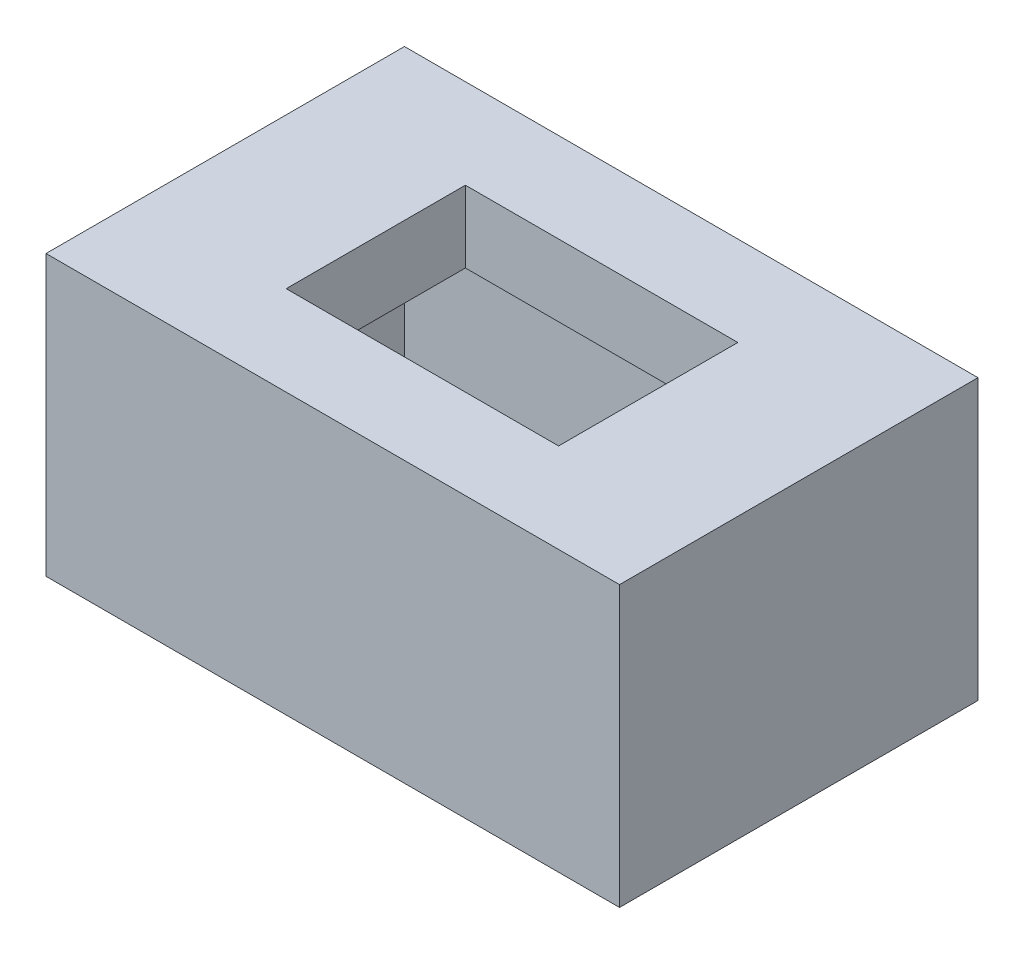
from build123d import *

# Parameters (mm, degrees)
SKETCH_1_W          = 80
SKETCH_1_H          = 50
EXTRUDE_1_DEPTH     = 40
SKETCH_2_W          = 70
SKETCH_2_H          = 40
CUT_EXTRUDE_1_DEPTH = 30
SKETCH_4_W          = 38
SKETCH_4_H          = 25
CUT_EXTRUDE_2_DEPTH = 30
SKETCH_7_W          = 80
SKETCH_7_H          = 50
SKETCH_7_W_2        = 75
SKETCH_7_H_2        = 45
CUT_EXTRUDE_3_DEPTH = 1


with BuildPart() as part:
    # 스케치1 → 보스-돌출1 (new body)
    with BuildSketch(Plane(origin=(0, 0, 0), x_dir=(1, 0, 0), z_dir=(0, 1, 0))):
        Rectangle(SKETCH_1_W, SKETCH_1_H)
    extrude(amount=EXTRUDE_1_DEPTH)

    # 스케치2 → 컷-돌출1 (cut)
    with BuildSketch(Plane.XZ):
        Rectangle(SKETCH_2_W, SKETCH_2_H)
    extrude(amount=-CUT_EXTRUDE_1_DEPTH, mode=Mode.SUBTRACT)

    # 스케치4 → 컷-돌출2 (cut)
    with BuildSketch(Plane(origin=(0, 40, 0), x_dir=(1, 0, 0), z_dir=(0, 1, 0))):
        Rectangle(SKETCH_4_W, SKETCH_4_H)
    extrude(amount=-CUT_EXTRUDE_2_DEPTH, mode=Mode.SUBTRACT)

    # 스케치7 → 컷-돌출3 (cut)
    with BuildSketch(Plane.XZ):
        Rectangle(SKETCH_7_W, SKETCH_7_H)
        Rectangle(SKETCH_7_W_2, SKETCH_7_H_2, mode=Mode.SUBTRACT)
    extrude(amount=-CUT_EXTRUDE_3_DEPTH, mode=Mode.SUBTRACT)


solid = part.part
